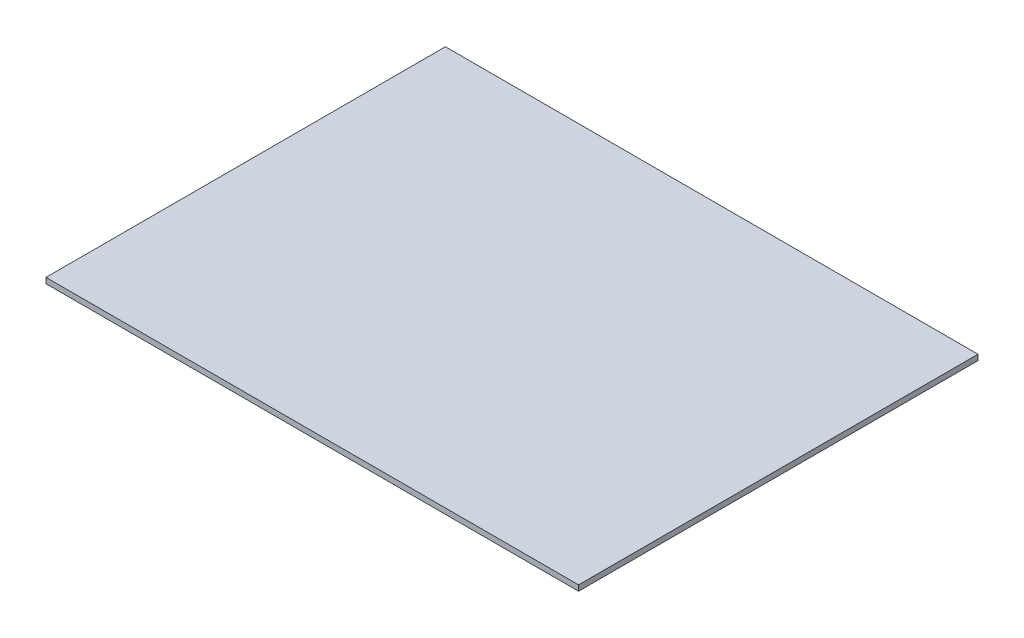
from build123d import *

# Parameters (mm, degrees)
SKETCH1_W           = 609.6
SKETCH1_H           = 457.2
BOSS_EXTRUDE1_DEPTH = 6.35


with BuildPart() as part:
    # Sketch1 → Boss-Extrude1 (new body)
    with BuildSketch(Plane(origin=(0, 0, 0), x_dir=(1, 0, 0), z_dir=(0, 1, 0))):
        Rectangle(SKETCH1_W, SKETCH1_H)
    extrude(amount=BOSS_EXTRUDE1_DEPTH)


solid = part.part
